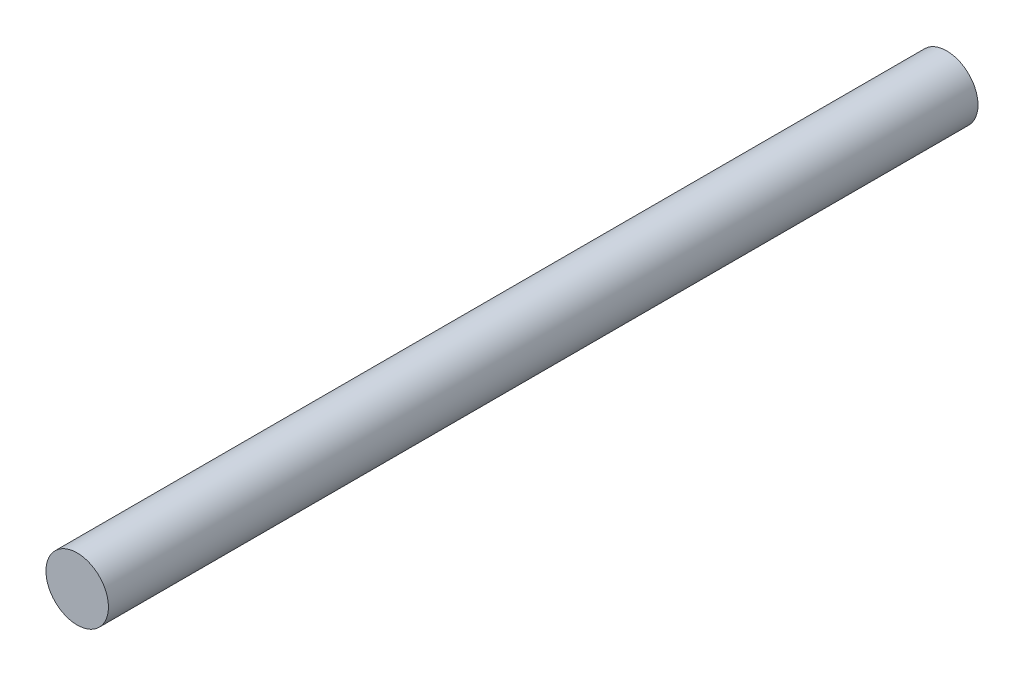
from build123d import *

# Parameters (mm, degrees)
SKETCH1_R           = 2.875
BOSS_EXTRUDE1_DEPTH = 80


with BuildPart() as part:
    # Sketch1 → Boss-Extrude1 (new body)
    with BuildSketch(Plane.XY):
        Circle(SKETCH1_R)
    extrude(amount=BOSS_EXTRUDE1_DEPTH)


solid = part.part
